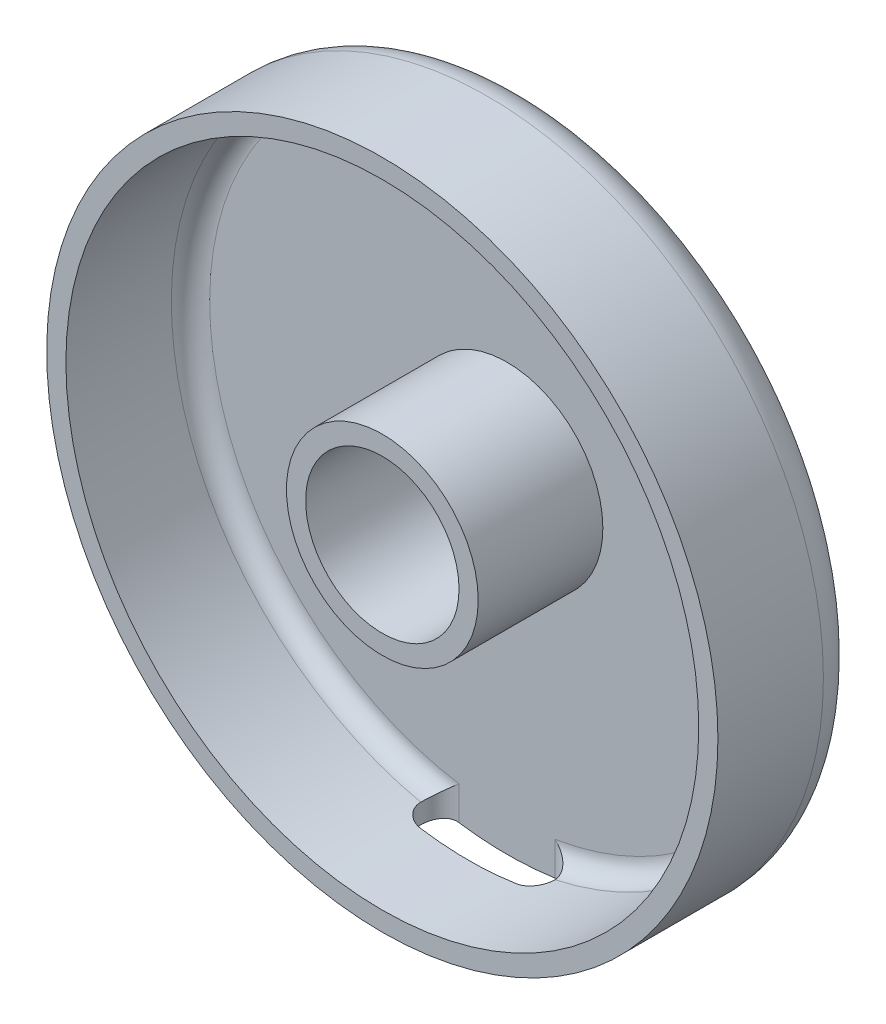
from build123d import *

# Parameters (mm, degrees)
CROQUIS1_R              = 35
SALIENTE_EXTRUIR1_DEPTH = 15
CROQUIS2_R              = 8
CORTAR_EXTRUIR1_DEPTH   = 52.720402164
VACIADO1_T              = -2
REDONDEO1_R             = 2
REDONDEO2_R             = 4
CORTAR_EXTRUIR2_START   = -25
CORTAR_EXTRUIR2_DEPTH   = 27.720402164


with BuildPart() as part:
    # Croquis1 → Saliente-Extruir1 (new body)
    with BuildSketch(Plane.XY):
        Circle(CROQUIS1_R)
    extrude(amount=SALIENTE_EXTRUIR1_DEPTH)

    # Croquis2 → Cortar-Extruir1 (cut, through all)
    with BuildSketch(Plane.XY.offset(15)):
        Circle(CROQUIS2_R)
    extrude(amount=-CORTAR_EXTRUIR1_DEPTH, mode=Mode.SUBTRACT)

    # Vaciado1
    vaciado1_openings = [part.faces().sort_by_distance(p)[0] for p in [
        (-34.010050506, 0, 15),
    ]]
    offset(amount=VACIADO1_T, openings=vaciado1_openings, kind=Kind.INTERSECTION)

    # Redondeo1
    redondeo1_edges = [part.edges().sort_by_distance(p)[0] for p in [
        (-33, 0, 2),
    ]]
    fillet(redondeo1_edges, radius=REDONDEO1_R)

    # Redondeo2
    redondeo2_edges = [part.edges().sort_by_distance(p)[0] for p in [
        (-35, 0, 0),
    ]]
    fillet(redondeo2_edges, radius=REDONDEO2_R)

    # Croquis3 → Cortar-Extruir2 (cut, through all)
    with BuildSketch(Plane(origin=(0, 0, 0), x_dir=(1, 0, 0), z_dir=(0, 1, 0)).offset(CORTAR_EXTRUIR2_START)):
        with BuildLine():
            Line((-5, -2), (5, -2))
            ThreePointArc((5, -2), (7, -4), (5, -6))
            Line((5, -6), (-5, -6))
            ThreePointArc((-5, -6), (-7, -4), (-5, -2))
        make_face()
    extrude(amount=-CORTAR_EXTRUIR2_DEPTH, mode=Mode.SUBTRACT)


solid = part.part
